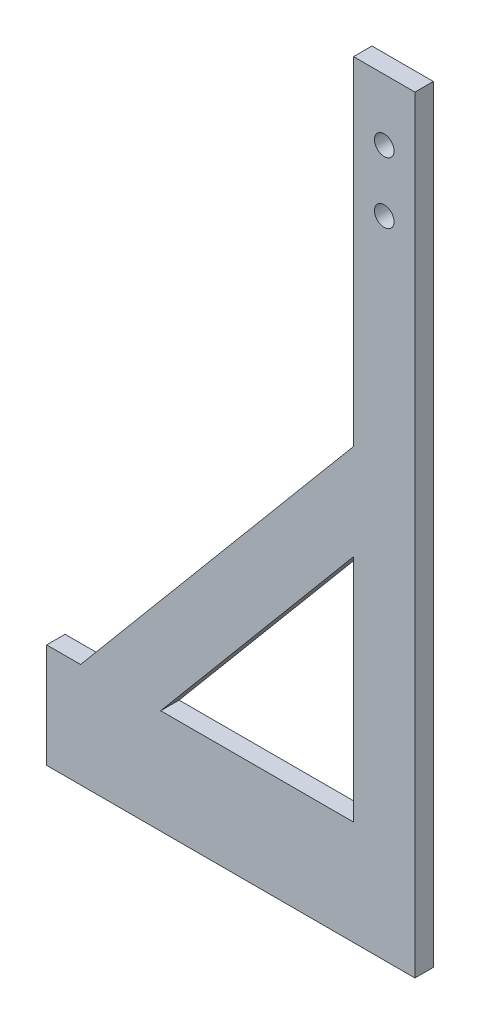
from build123d import *

# Parameters (mm, degrees)
AUFSATZ_LINEAR_AUSTRAGEN1_DEPTH      = 3
F_3_2_3_2_DURCHMESSER_BOHRUNG1_D     = 3.2
F_3_2_3_2_DURCHMESSER_BOHRUNG1_DEPTH = 8.5
F_3_2_3_2_DURCHMESSER_BOHRUNG1_TIP   = 0.96137699


with BuildPart() as part:
    # Skizze1 → Aufsatz-Linear austragen1 (new body)
    with BuildSketch(Plane.XY):
        Polygon((-10, 70), (-54.472280452, 17), (-60, 17), (-60, 0), (0, 0), (0, 125), (-10, 125), align=None)
        Polygon((-10, 54.442761731), (-41.418207559, 17), (-10, 17), align=None, mode=Mode.SUBTRACT)
    extrude(amount=AUFSATZ_LINEAR_AUSTRAGEN1_DEPTH)

    # Ø3.2 (3.2) Durchmesser Bohrung1
    with Locations(Plane.XY.offset(3)):
        with Locations((-5, 115), (-5, 105)):
            Hole(F_3_2_3_2_DURCHMESSER_BOHRUNG1_D / 2, depth=F_3_2_3_2_DURCHMESSER_BOHRUNG1_DEPTH)
            with Locations((0, 0, -(F_3_2_3_2_DURCHMESSER_BOHRUNG1_DEPTH + F_3_2_3_2_DURCHMESSER_BOHRUNG1_TIP / 2))):  # 118° drill point
                Cone(0, F_3_2_3_2_DURCHMESSER_BOHRUNG1_D / 2, F_3_2_3_2_DURCHMESSER_BOHRUNG1_TIP, mode=Mode.SUBTRACT)


solid = part.part
